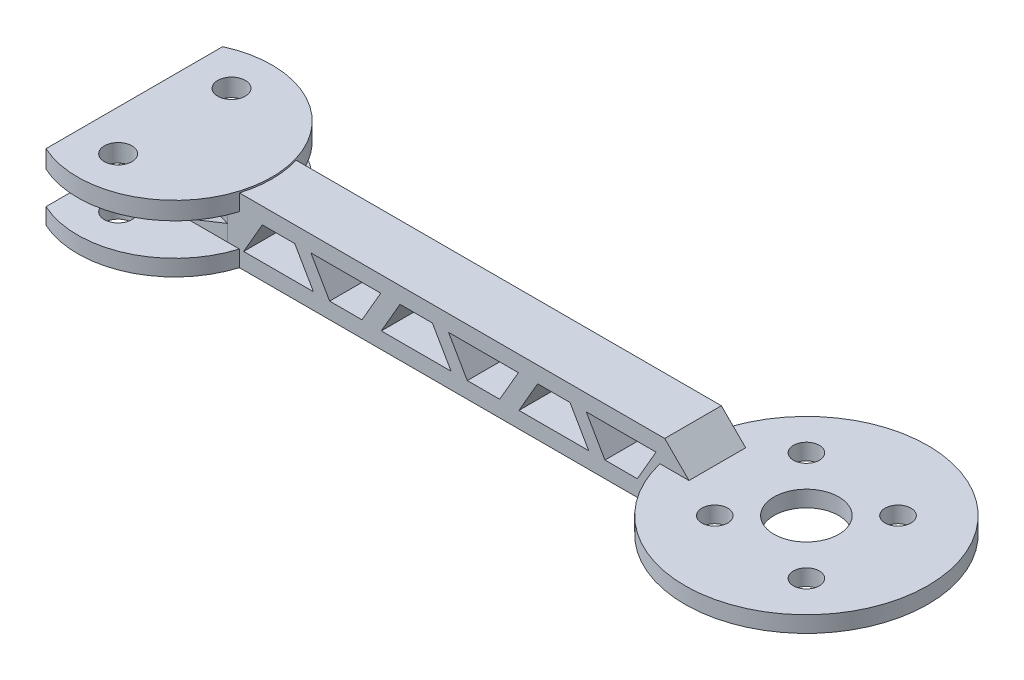
from build123d import *

# Parameters (mm, degrees)
SKETCH_1_W               = 54.25
SKETCH_1_H               = 7
EXTRUDE_1_DEPTH          = 2
SKETCH_2_R               = 12
SKETCH_2_R_2             = 1.7
EXTRUDE_2_DEPTH          = 2
EXTRUDE_START            = 6
SKETCH_3_R               = 12
SKETCH_3_R_2             = 1.7
EXTRUDE_3_DEPTH          = 2.2
EXTRUDE_5_DEPTH          = 1
EXTRUDE_5_DEPTH_BACK     = 1
SKETCH_5_R               = 15
SKETCH_5_R_2             = 1.6
SKETCH_5_R_3             = 4
EXTRUDE_START_2          = -3.5
EXTRUDE_6_DEPTH          = 7
GUSSET_1_THICKNESS       = 7
GUSSET_2_THICKNESS       = 7
CUT_EXTRUDE_1_DEPTH      = 10
CUT_EXTRUDE_1_DEPTH_BACK = 10
SKETCH_9_W               = 10
SKETCH_9_H               = 24.43853107


with BuildPart() as part:
    # 草图1 → 凸台-拉伸1 (new body)
    with BuildSketch(Plane(origin=(0, 0, 0), x_dir=(1, 0, 0), z_dir=(0, 1, 0))):
        with Locations((27.125, 0)):
            Rectangle(SKETCH_1_W, SKETCH_1_H)
    extrude(amount=EXTRUDE_1_DEPTH)

    # 草图2 → 凸台-拉伸2 (add)
    with BuildSketch(Plane(origin=(0, 0, 0), x_dir=(1, 0, 0), z_dir=(0, 1, 0))):
        Circle(SKETCH_2_R)
        with Locations(Location((0, -7, 0), (0, 0, 270))):
            Circle(SKETCH_2_R_2, mode=Mode.SUBTRACT)
        with Locations(Location((0, 7, 0), (0, 0, 270))):
            Circle(SKETCH_2_R_2, mode=Mode.SUBTRACT)
    extrude(amount=EXTRUDE_2_DEPTH)



with BuildPart() as body_2:
    # 草图3 → 凸台-拉伸3 (new body)
    with BuildSketch(Plane(origin=(0, 0, 0), x_dir=(1, 0, 0), z_dir=(0, 1, 0)).offset(EXTRUDE_START)):
        with Locations(Location((0, 0, 0), (0, 0, 270))):
            Circle(SKETCH_3_R)
        with Locations(Location((0, -7, 0), (0, 0, 270))):
            Circle(SKETCH_3_R_2, mode=Mode.SUBTRACT)
        with Locations(Location((0, 7, 0), (0, 0, 270))):
            Circle(SKETCH_3_R_2, mode=Mode.SUBTRACT)
    extrude(amount=EXTRUDE_3_DEPTH)


with BuildPart() as body_3:
    # 草图5 → 凸台-拉伸5 (new, two sides: drawn at the far end of the back side and taken through both)
    with BuildSketch(Plane(origin=(0, 4, 0), x_dir=(1, 0, 0), z_dir=(0, 1, 0)).offset(-EXTRUDE_5_DEPTH_BACK)):
        with Locations(Location((78, 0, 0), (0, 0, 270))):
            Circle(SKETCH_5_R)
        with Locations(Location((72.343145751, -5.656854249, 0), (0, 0, 270))):
            Circle(SKETCH_5_R_2, mode=Mode.SUBTRACT)
        with Locations(Location((71.282485579, 6.717514421, 0), (0, 0, 270))):
            Circle(SKETCH_5_R_2, mode=Mode.SUBTRACT)
        with Locations(Location((84.717514421, -6.717514421, 0), (0, 0, 270))):
            Circle(SKETCH_5_R_2, mode=Mode.SUBTRACT)
        with Locations(Location((83.656854249, 5.656854249, 0), (0, 0, 270))):
            Circle(SKETCH_5_R_2, mode=Mode.SUBTRACT)
        with Locations(Location((78, 0, 0), (0, 0, 270))):
            Circle(SKETCH_5_R_3, mode=Mode.SUBTRACT)
    extrude(amount=EXTRUDE_5_DEPTH + EXTRUDE_5_DEPTH_BACK)


with BuildPart() as part_1:
    add(part.part)

    add(body_2.part)  # 凸台-拉伸6 merges body 2

    add(body_3.part)  # 凸台-拉伸6 merges body 3
    # 草图6 → 凸台-拉伸6 (add)
    with BuildSketch(Plane.XY.offset(EXTRUDE_START_2)):
        Polygon((10, 0), (64, 0), (67, 3), (67, 5), (64, 8), (10, 8), align=None)
        Polygon((31.309401077, 6), (29, 2), (37.618802154, 2), (35.309401077, 6), align=None, mode=Mode.SUBTRACT)
        Polygon((12, 2), (20.618802154, 2), (18.309401077, 6), (14.309401077, 6), align=None, mode=Mode.SUBTRACT)
        Polygon((20.309401077, 6), (28.92820323, 6), (26.618802154, 2), (22.618802154, 2), align=None, mode=Mode.SUBTRACT)
        Polygon((39.618802154, 2), (37.309401077, 6), (45.92820323, 6), (43.618802154, 2), align=None, mode=Mode.SUBTRACT)
        Polygon((48.309401077, 6), (46, 2), (54.618802154, 2), (52.309401077, 6), align=None, mode=Mode.SUBTRACT)
        Polygon((56.618802154, 2), (54.309401077, 6), (62.92820323, 6), (60.618802154, 2), align=None, mode=Mode.SUBTRACT)
    extrude(amount=EXTRUDE_6_DEPTH)

    # 草图9 → 切除-拉伸1 (cut, two sides: drawn at the far end of the back side and taken through both)
    with BuildSketch(Plane(origin=(0, 4, 0), x_dir=(-1, 0, 0), z_dir=(0, -1, 0)).offset(-CUT_EXTRUDE_1_DEPTH_BACK)):
        with Locations((10, 0)):
            Rectangle(SKETCH_9_W, SKETCH_9_H)
    extrude(amount=CUT_EXTRUDE_1_DEPTH + CUT_EXTRUDE_1_DEPTH_BACK, mode=Mode.SUBTRACT)


with BuildPart() as body_2_2:
    # Gusset 1: a gusset: a plate 7.0 thick in the corner of two members, its outline drawn in place
    gusset_1_outline = Wire([Line((10, 6, -3.5), (10, 4, -3.5)), Line((10, 4, -3.5), (5, 6, -3.5)), Line((5, 6, -3.5), (10, 6, -3.5))])
    add(extrude(Face(gusset_1_outline), amount=GUSSET_1_THICKNESS, dir=(0, 0, 1)))


with BuildPart() as body_3_2:
    # Gusset 2: a gusset: a plate 7.0 thick in the corner of two members, its outline drawn in place
    gusset_2_outline = Wire([Line((10, 2, 3.5), (10, 4, 3.5)), Line((10, 4, 3.5), (5, 2, 3.5)), Line((5, 2, 3.5), (10, 2, 3.5))])
    add(extrude(Face(gusset_2_outline), amount=GUSSET_2_THICKNESS, dir=(0, 0, -1)))


solid = Compound([part_1.part, body_2_2.part, body_3_2.part])
